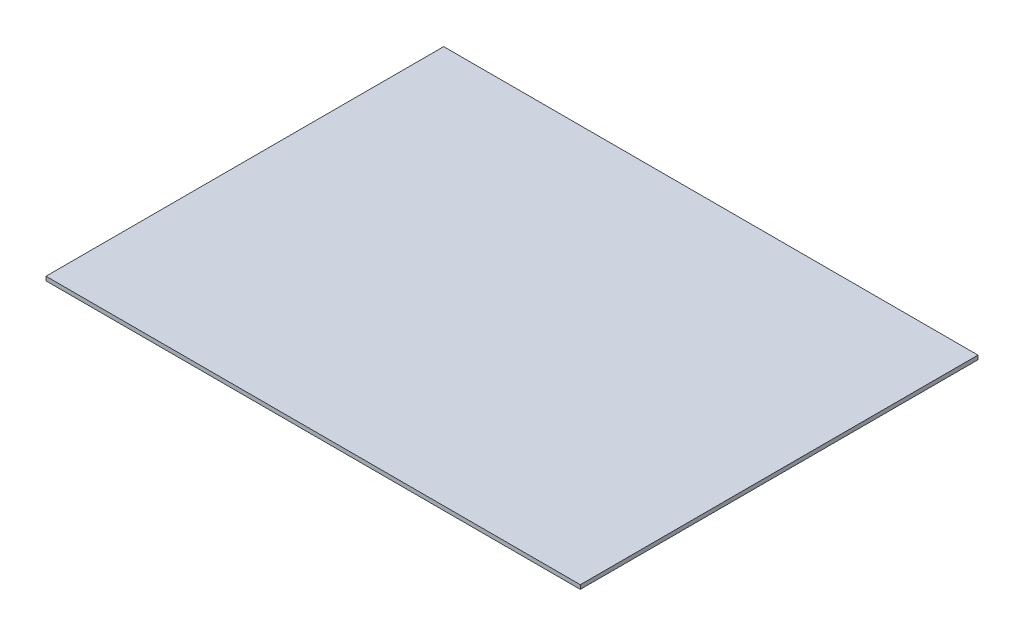
from build123d import *

# Parameters (mm, degrees)
SKETCH1_W           = 395
SKETCH1_H           = 294
BOSS_EXTRUDE1_DEPTH = 3


with BuildPart() as part:
    # Sketch1 → Boss-Extrude1 (new body)
    with BuildSketch(Plane(origin=(0, 0, 0), x_dir=(1, 0, 0), z_dir=(0, 1, 0))):
        Rectangle(SKETCH1_W, SKETCH1_H)
    extrude(amount=BOSS_EXTRUDE1_DEPTH)


solid = part.part
